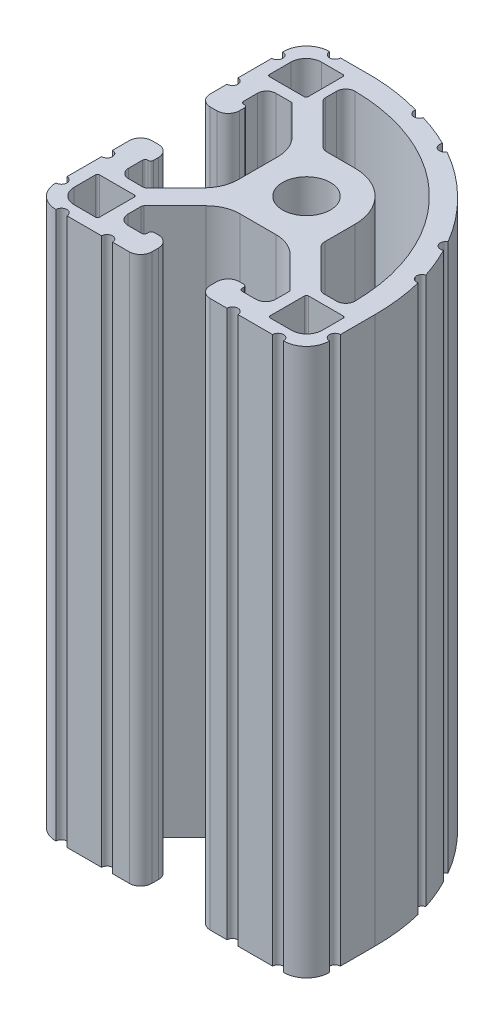
from build123d import *

# Parameters (mm, degrees)
SKETCH12_R                = 3.3274
F_15_1517_PROFILE_1_DEPTH = 76.2


with BuildPart() as part:
    # Sketch12 → 15 1517 PROFILE(1) (new body)
    with BuildSketch(Plane(origin=(0, -38.1, 0), x_dir=(-1, 0, 0), z_dir=(0, 1, 0))):
        with BuildLine():
            Line((-5.855816591, 8.147584211), (-10.175407684, 12.467175304))
            ThreePointArc((-10.175407684, 12.467175304), (-10.257998102, 12.590780599), (-10.287, 12.736582987))
            Line((-10.287, 12.736582987), (-10.287, 14.569878534))
            ThreePointArc((-10.287, 14.569878534), (-9.878755558, 15.555467801), (-8.89316629, 15.963712243))
            Line((-8.89316629, 15.963712243), (-6.999167103, 15.963712243))
            ThreePointArc((-6.999167103, 15.963712243), (-6.72975942, 15.852119927), (-6.618167103, 15.582712243))
            Line((-6.618167103, 15.582712243), (-6.618167103, 15.367))
            ThreePointArc((-6.618167103, 15.367), (-6.506574787, 15.097592316), (-6.237167103, 14.986))
            Line((-6.237167103, 14.986), (-5.6388, 14.986))
            ThreePointArc((-5.6388, 14.986), (-4.525248241, 15.447248241), (-4.064, 16.5608))
            Line((-4.064, 16.5608), (-4.064, 17.4752))
            ThreePointArc((-4.064, 17.4752), (-4.525248241, 18.588751759), (-5.6388, 19.05))
            Line((-5.6388, 19.05), (-7.975808612, 19.05))
            ThreePointArc((-7.975808612, 19.05), (-8.737808612, 18.288), (-9.499808612, 19.05))
            Line((-9.499808612, 19.05), (-14.328223272, 19.05))
            ThreePointArc((-14.328223272, 19.05), (-15.090223272, 18.288), (-15.852223272, 19.05))
            Line((-15.852223272, 19.05), (-15.875852034, 19.05))
            ThreePointArc((-15.875852034, 19.05), (-18.12054407, 18.120435963), (-19.05085186, 15.87605207))
            Line((-19.05085186, 15.87605207), (-19.050837856, 15.850579848))
            ThreePointArc((-19.050837856, 15.850579848), (-18.288384143, 15.088998911), (-19.05, 14.32658008))
            Line((-19.05, 14.32658008), (-19.05, 12.732288231))
            Line((-19.05, 12.732288231), (-19.05, 9.525048511))
            ThreePointArc((-19.05, 9.525048511), (-18.844960924, 6.073606423), (-18.224093909, 2.672280555))
            ThreePointArc((-18.224093909, 2.672280555), (-17.297425672, 2.136472625), (-17.820830396, 1.202742656))
            ThreePointArc((-17.820830396, 1.202742656), (-17.023706771, -0.946565585), (-16.056863602, -3.025061742))
            ThreePointArc((-16.056863602, -3.025061742), (-15.035371139, -3.344995028), (-15.341656086, -4.370662465))
            ThreePointArc((-15.341656086, -4.370662465), (-13.165262011, -7.582681452), (-10.573808085, -10.470262392))
            ThreePointArc((-10.573808085, -10.470262392), (-7.668241397, -13.006038729), (-4.447687438, -15.127479658))
            ThreePointArc((-4.447687438, -15.127479658), (-3.422020001, -14.821194711), (-3.102086715, -15.842687174))
            ThreePointArc((-3.102086715, -15.842687174), (-0.919134849, -16.817197941), (1.337634319, -17.605831579))
            ThreePointArc((1.337634319, -17.605831579), (2.271364288, -17.082426855), (2.807172217, -18.009095093))
            ThreePointArc((2.807172217, -18.009095093), (6.128127796, -18.72920779), (9.511085172, -19.05))
            Line((9.511085172, -19.05), (12.718324892, -19.05))
            Line((12.718324892, -19.05), (14.313588533, -19.05))
            ThreePointArc((14.313588533, -19.05), (15.075956274, -18.288384117), (15.837588355, -19.050735675))
            ThreePointArc((15.837588355, -19.050735675), (18.15779509, -18.085838645), (19.05, -15.736720519))
            ThreePointArc((19.05, -15.736720519), (18.288, -14.974720519), (19.05, -14.212720519))
            Line((19.05, -14.212720519), (19.05, -9.494484795))
            ThreePointArc((19.05, -9.494484795), (18.288, -8.732484795), (19.05, -7.970484795))
            Line((19.05, -7.970484795), (19.05, -5.6388))
            ThreePointArc((19.05, -5.6388), (18.588751759, -4.525248241), (17.4752, -4.064))
            Line((17.4752, -4.064), (16.5608, -4.064))
            ThreePointArc((16.5608, -4.064), (15.447248241, -4.525248241), (14.986, -5.6388))
            Line((14.986, -5.6388), (14.986, -6.323339378))
            ThreePointArc((14.986, -6.323339378), (15.097592316, -6.592747061), (15.367, -6.704339378))
            Line((15.367, -6.704339378), (15.458830022, -6.704339378))
            ThreePointArc((15.458830022, -6.704339378), (15.728237706, -6.815931694), (15.839830022, -7.085339378))
            Line((15.839830022, -7.085339378), (15.839830022, -9.017))
            ThreePointArc((15.839830022, -9.017), (15.467855635, -9.915025612), (14.569830022, -10.287))
            Line((14.569830022, -10.287), (12.463570685, -10.287))
            ThreePointArc((12.463570685, -10.287), (12.317768298, -10.257998102), (12.194163002, -10.175407684))
            Line((12.194163002, -10.175407684), (8.148592848, -6.12983753))
            ThreePointArc((8.148592848, -6.12983753), (7.118219133, -4.58777429), (6.7564, -2.768786675))
            Line((6.7564, -2.768786675), (6.7564, 2.768786675))
            ThreePointArc((6.7564, 2.768786675), (7.118219133, 4.58777429), (8.148592848, 6.12983753))
            Line((8.148592848, 6.12983753), (12.194163002, 10.175407684))
            ThreePointArc((12.194163002, 10.175407684), (12.317768298, 10.257998102), (12.463570685, 10.287))
            Line((12.463570685, 10.287), (14.503581688, 10.287))
            ThreePointArc((14.503581688, 10.287), (15.4016073, 9.915025612), (15.773581688, 9.017))
            Line((15.773581688, 9.017), (15.773581688, 7.085339378))
            ThreePointArc((15.773581688, 7.085339378), (15.661989372, 6.815931694), (15.392581688, 6.704339378))
            Line((15.392581688, 6.704339378), (15.367, 6.704339378))
            ThreePointArc((15.367, 6.704339378), (15.097592316, 6.592747061), (14.986, 6.323339378))
            Line((14.986, 6.323339378), (14.986, 5.6388))
            ThreePointArc((14.986, 5.6388), (15.447248241, 4.525248241), (16.5608, 4.064))
            Line((16.5608, 4.064), (17.4752, 4.064))
            ThreePointArc((17.4752, 4.064), (18.588751759, 4.525248241), (19.05, 5.6388))
            Line((19.05, 5.6388), (19.05, 7.975937164))
            ThreePointArc((19.05, 7.975937164), (18.288, 8.737937164), (19.05, 9.499937164))
            Line((19.05, 9.499937164), (19.05, 14.328351583))
            ThreePointArc((19.05, 14.328351583), (18.288, 15.090351583), (19.05, 15.852351583))
            Line((19.05, 15.852351583), (19.05, 15.875001064))
            ThreePointArc((19.05, 15.875001064), (18.120064074, 18.120063986), (15.875001189, 19.05))
            Line((15.875001189, 19.05), (15.847027528, 19.05))
            ThreePointArc((15.847027528, 19.05), (15.085027528, 18.288), (14.323027528, 19.05))
            Line((14.323027528, 19.05), (9.494612868, 19.05))
            ThreePointArc((9.494612868, 19.05), (8.732612868, 18.288), (7.970612868, 19.05))
            Line((7.970612868, 19.05), (5.6388, 19.05))
            ThreePointArc((5.6388, 19.05), (4.525248241, 18.588751759), (4.064, 17.4752))
            Line((4.064, 17.4752), (4.064, 16.5608))
            ThreePointArc((4.064, 16.5608), (4.525248241, 15.447248241), (5.6388, 14.986))
            Line((5.6388, 14.986), (6.237167103, 14.986))
            ThreePointArc((6.237167103, 14.986), (6.506574787, 15.097592316), (6.618167103, 15.367))
            Line((6.618167103, 15.367), (6.618167103, 15.582712243))
            ThreePointArc((6.618167103, 15.582712243), (6.72975942, 15.852119927), (6.999167103, 15.963712243))
            Line((6.999167103, 15.963712243), (8.89316629, 15.963712243))
            ThreePointArc((8.89316629, 15.963712243), (9.878755558, 15.555467801), (10.287, 14.569878534))
            Line((10.287, 14.569878534), (10.287, 12.736582987))
            ThreePointArc((10.287, 12.736582987), (10.257998102, 12.590780599), (10.175407684, 12.467175304))
            Line((10.175407684, 12.467175304), (5.855816591, 8.147584211))
            ThreePointArc((5.855816591, 8.147584211), (4.314870569, 7.117956996), (2.497200801, 6.7564))
            Line((2.497200801, 6.7564), (-2.497200801, 6.7564))
            ThreePointArc((-2.497200801, 6.7564), (-4.314870569, 7.117956996), (-5.855816591, 8.147584211))
        make_face()
        Circle(SKETCH12_R, mode=Mode.SUBTRACT)
        with BuildLine():
            Line((11.8872, 16.9672), (11.8872, 12.094133798))
            ThreePointArc((11.8872, 12.094133798), (11.961594878, 11.914528676), (12.1412, 11.840133798))
            Line((12.1412, 11.840133798), (17.018, 11.840133798))
            ThreePointArc((17.018, 11.840133798), (17.197605122, 11.914528676), (17.272, 12.094133798))
            Line((17.272, 12.094133798), (17.272, 15.0876))
            ThreePointArc((17.272, 15.0876), (16.647083028, 16.596283028), (15.1384, 17.2212))
            Line((15.1384, 17.2212), (12.1412, 17.2212))
            ThreePointArc((12.1412, 17.2212), (11.961594878, 17.146805122), (11.8872, 16.9672))
        make_face(mode=Mode.SUBTRACT)
        with BuildLine():
            Line((11.892254607, -12.094133798), (11.892254607, -16.9672))
            ThreePointArc((11.892254607, -16.9672), (11.966649484, -17.146805122), (12.146254607, -17.2212))
            Line((12.146254607, -17.2212), (15.1384, -17.2212))
            ThreePointArc((15.1384, -17.2212), (16.647083028, -16.596283028), (17.272, -15.0876))
            Line((17.272, -15.0876), (17.272, -12.094133798))
            ThreePointArc((17.272, -12.094133798), (17.197605122, -11.914528676), (17.018, -11.840133798))
            Line((17.018, -11.840133798), (12.146254607, -11.840133798))
            ThreePointArc((12.146254607, -11.840133798), (11.966649484, -11.914528676), (11.892254607, -12.094133798))
        make_face(mode=Mode.SUBTRACT)
        with BuildLine():
            Line((10.571349784, -14.767607354), (10.571349784, -13.231353261))
            ThreePointArc((10.571349784, -13.231353261), (10.503678689, -12.89114769), (10.310967713, -12.602735333))
            Line((10.310967713, -12.602735333), (4.836606768, -7.128374388))
            ThreePointArc((4.836606768, -7.128374388), (4.424589115, -6.853072994), (3.938581156, -6.7564))
            Line((3.938581156, -6.7564), (0, -6.7564))
            ThreePointArc((0, -6.7564), (-4.777496256, -4.777496256), (-6.7564, 0))
            Line((-6.7564, 0), (-6.7564, 4.211593458))
            ThreePointArc((-6.7564, 4.211593458), (-6.853072994, 4.697601417), (-7.128374388, 5.10961907))
            Line((-7.128374388, 5.10961907), (-12.326279328, 10.307524009))
            ThreePointArc((-12.326279328, 10.307524009), (-12.614691685, 10.500234985), (-12.954897256, 10.567906081))
            Line((-12.954897256, 10.567906081), (-14.764163651, 10.567906081))
            ThreePointArc((-14.764163651, 10.567906081), (-15.665716473, 10.192390575), (-16.034124311, 9.287910033))
            ThreePointArc((-16.034124311, 9.287910033), (-8.566079095, -8.553631535), (9.268959288, -16.037194238))
            ThreePointArc((9.268959288, -16.037194238), (10.187849663, -15.677012635), (10.571349784, -14.767607354))
        make_face(mode=Mode.SUBTRACT)
        with BuildLine():
            Line((-17.272, 15.0876), (-17.272, 12.1411746))
            ThreePointArc((-17.272, 12.1411746), (-17.197605122, 11.961569478), (-17.018, 11.8871746))
            Line((-17.018, 11.8871746), (-12.1412, 11.8871746))
            ThreePointArc((-12.1412, 11.8871746), (-11.961594878, 11.961569478), (-11.8872, 12.1411746))
            Line((-11.8872, 12.1411746), (-11.8872, 16.9672))
            ThreePointArc((-11.8872, 16.9672), (-11.961594878, 17.146805122), (-12.1412, 17.2212))
            Line((-12.1412, 17.2212), (-15.1384, 17.2212))
            ThreePointArc((-15.1384, 17.2212), (-16.647083028, 16.596283028), (-17.272, 15.0876))
        make_face(mode=Mode.SUBTRACT)
    extrude(amount=F_15_1517_PROFILE_1_DEPTH)


solid = part.part
